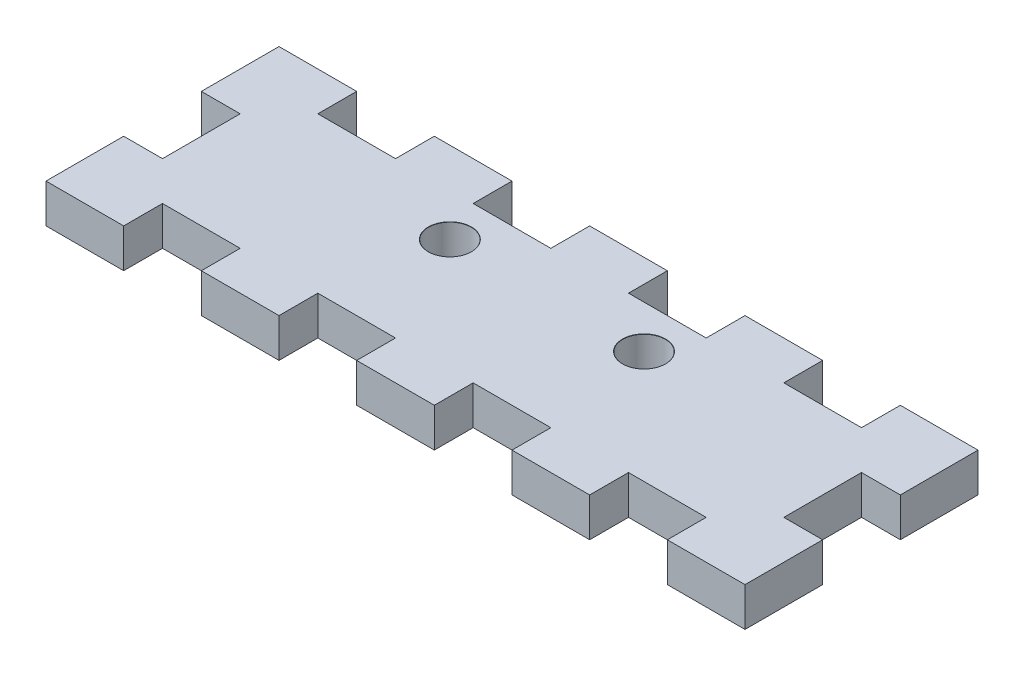
from build123d import *

# Parameters (mm, degrees)
BOSS_EXTRUDE1_DEPTH            = 2.5
M5_CLEARANCE_HOLE1_D           = 5.5
M5_CLEARANCE_HOLE1_CSINK_D     = 5.55
M5_CLEARANCE_HOLE1_CSINK_ANGLE = 90


with BuildPart() as part:
    # Sketch1 → Boss-Extrude1 (new, symmetric)
    with BuildSketch(Plane(origin=(0, 0, 0), x_dir=(1, 0, 0), z_dir=(0, 1, 0))):
        Polygon((45, 15), (40, 15), (35, 15), (35, 10), (25, 10), (25, 15), (15, 15), (15, 10), (5, 10), (5, 15), (-5, 15), (-5, 10), (-15, 10), (-15, 15), (-25, 15), (-25, 10), (-35, 10), (-35, 15), (-40, 15), (-45, 15), (-45, 10), (-45, 5), (-40, 5), (-40, -5), (-45, -5), (-45, -10), (-45, -15), (-40, -15), (-35, -15), (-35, -10), (-25, -10), (-25, -15), (-15, -15), (-15, -10), (-5, -10), (-5, -15), (5, -15), (5, -10), (15, -10), (15, -15), (25, -15), (25, -10), (35, -10), (35, -15), (40, -15), (45, -15), (45, -10), (45, -5), (40, -5), (40, 5), (45, 5), (45, 10), align=None)
    extrude(amount=BOSS_EXTRUDE1_DEPTH, both=True)

    # M5 Clearance Hole1 (through all)
    with Locations(Plane(origin=(0, 2.5, 0), x_dir=(1, 0, 0), z_dir=(0, 1, 0))):
        with Locations((12.5, 4.5), (-12.5, 4.5)):
            CounterSinkHole(M5_CLEARANCE_HOLE1_D / 2, M5_CLEARANCE_HOLE1_CSINK_D / 2, counter_sink_angle=M5_CLEARANCE_HOLE1_CSINK_ANGLE)


solid = part.part
